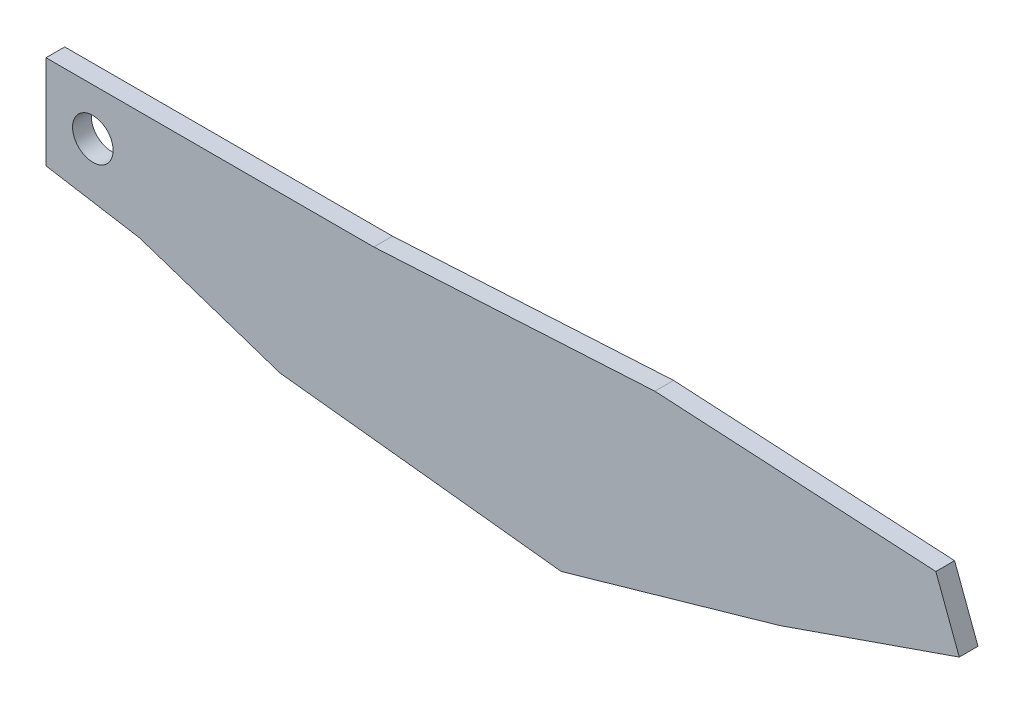
from build123d import *

# Parameters (mm, degrees)
SKETCH_1_R        = 1.3
EXTRUDE_127_DEPTH = 1.2


with BuildPart() as part:
    # 草图1 → 柔性桨叶包络_展开总径127 (new body)
    with BuildSketch(Plane.XY):
        Polygon((-3, -3), (3, -4), (12, -7), (30, -9), (44, -5), (55.5, -1), (54, 3), (36, 4), (18, 3), (4, 3), (-3, 3), align=None)
        Circle(SKETCH_1_R, mode=Mode.SUBTRACT)
    extrude(amount=EXTRUDE_127_DEPTH)


solid = part.part
